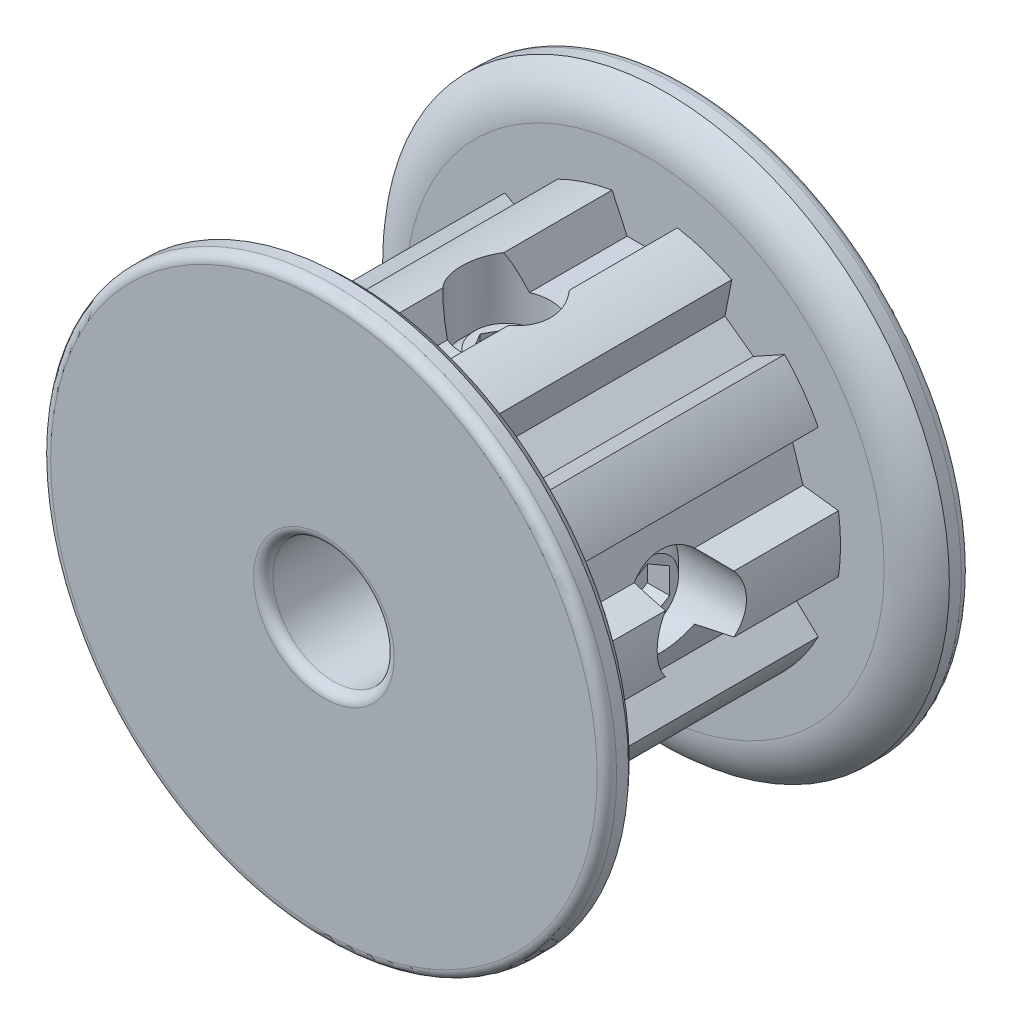
from build123d import *

# Parameters (mm, degrees)
CUT_EXTRUDE1_START = 5.4483
CUT_EXTRUDE1_DEPTH = 10.8966
CIRPATTERN1_COUNT  = 10
FILLET1_R          = 0.381
SKETCH5_R          = 1.7526
CUT_EXTRUDE2_DEPTH = 18.265550744
CUT_EXTRUDE3_DEPTH = 0.8763
CIRPATTERN2_COUNT  = 2
CIRPATTERN2_ANGLE  = 270


with BuildPart() as part:
    # Sketch2 → Revolve1 (revolve)
    with BuildSketch(Plane(origin=(0, 0, 0), x_dir=(0, 0, -1), z_dir=(1, 0, 0)), mode=Mode.PRIVATE) as revolve1_sk:
        with BuildLine():
            Line((-7.1501, 2.38125), (7.1501, 2.38125))
            Line((7.1501, 2.38125), (7.1501, 11.1125))
            Line((7.1501, 11.1125), (6.2992, 11.1125))
            ThreePointArc((6.2992, 11.1125), (5.672760616, 10.35671356), (5.4483, 9.401068816))
            Line((5.4483, 9.401068816), (5.4483, 7.689637631))
            Line((5.4483, 7.689637631), (-5.4483, 7.689637631))
            Line((-5.4483, 7.689637631), (-5.4483, 9.401068816))
            ThreePointArc((-5.4483, 9.401068816), (-5.672760616, 10.35671356), (-6.2992, 11.1125))
            Line((-6.2992, 11.1125), (-7.1501, 11.1125))
            Line((-7.1501, 11.1125), (-7.1501, 2.38125))
        make_face()
    revolve(revolve1_sk.sketch.rotate(Axis((0, 0, 7.1501), (0, 0, -1)), 90), axis=Axis((0, 0, 7.1501), (0, 0, -1)))

    # Sketch3 → Cut-Extrude1 (cut)
    with BuildSketch(Plane.XY.offset(CUT_EXTRUDE1_START)):
        with BuildLine():
            Line((-0.690489274, 6.3119), (0.690489274, 6.3119))
            Line((0.690489274, 6.3119), (1.2827, 7.5819))
            ThreePointArc((1.2827, 7.5819), (0, 7.689637631), (-1.2827, 7.5819))
            Line((-1.2827, 7.5819), (-0.690489274, 6.3119))
        make_face()
    cut_extrude1 = extrude(amount=-CUT_EXTRUDE1_DEPTH, mode=Mode.SUBTRACT)

    # CirPattern1: Cut-Extrude1 ×10 about axis
    cirpattern1_axis = Axis((0, 0, 0), (0, 0, 1))
    for i in range(1, CIRPATTERN1_COUNT):
        add(cut_extrude1.rotate(cirpattern1_axis, i * 360 / CIRPATTERN1_COUNT), mode=Mode.SUBTRACT)

    # Fillet1
    fillet1_edges = [part.edges().sort_by_distance(p)[0] for p in [
        (-11.1125, 0, -7.1501),
        (-2.38125, 0, -7.1501),
        (-2.38125, 0, 7.1501),
        (-11.1125, 0, 7.1501),
    ]]
    fillet(fillet1_edges, radius=FILLET1_R)

    # Sketch5 → Cut-Extrude2 (cut, through all)
    with BuildSketch(Plane(origin=(0, 0, 0), x_dir=(1, 0, 0), z_dir=(0, 1, 0))):
        with Locations(Location((0, 0, 0), (0, 0, 90))):
            Circle(SKETCH5_R)
    cut_extrude2 = extrude(amount=CUT_EXTRUDE2_DEPTH, mode=Mode.SUBTRACT)

    # Sketch6 → Revolve2 (revolve)
    with BuildSketch(Plane(origin=(0, 0, 0), x_dir=(0, 0, -1), z_dir=(1, 0, 0)), mode=Mode.PRIVATE) as revolve2_sk:
        Polygon((0, 5.5499), (0, 3.14325), (-1.22682, 3.14325), (-1.7526, 3.66903), (-1.7526, 5.02412), (-1.22682, 5.5499), align=None)
    revolve2 = revolve(revolve2_sk.sketch.rotate(Axis((0, 5.5499, 0), (0, -1, 0)), 180), axis=Axis((0, 5.5499, 0), (0, -1, 0)))

    # Sketch7 → Cut-Extrude3 (cut)
    with BuildSketch(Plane(origin=(0, 5.5499, 0), x_dir=(1, 0, 0), z_dir=(0, 1, 0))):
        Polygon((1.011864082, 0), (0.505932041, 0.8763), (-0.505932041, 0.8763), (-1.011864082, 0), (-0.505932041, -0.8763), (0.505932041, -0.8763), align=None)
    cut_extrude3 = extrude(amount=-CUT_EXTRUDE3_DEPTH, mode=Mode.SUBTRACT)

    # CirPattern2: Cut-Extrude2, Revolve2, Cut-Extrude3 ×2 about axis
    cirpattern2_axis = Axis((0, 0, 0), (0, 0, 1))
    add([cut_extrude2.rotate(cirpattern2_axis, i * CIRPATTERN2_ANGLE / (CIRPATTERN2_COUNT - 1)) for i in range(1, CIRPATTERN2_COUNT)], mode=Mode.SUBTRACT)
    add([revolve2.rotate(cirpattern2_axis, i * CIRPATTERN2_ANGLE / (CIRPATTERN2_COUNT - 1)) for i in range(1, CIRPATTERN2_COUNT)])
    add([cut_extrude3.rotate(cirpattern2_axis, i * CIRPATTERN2_ANGLE / (CIRPATTERN2_COUNT - 1)) for i in range(1, CIRPATTERN2_COUNT)], mode=Mode.SUBTRACT)


solid = part.part
